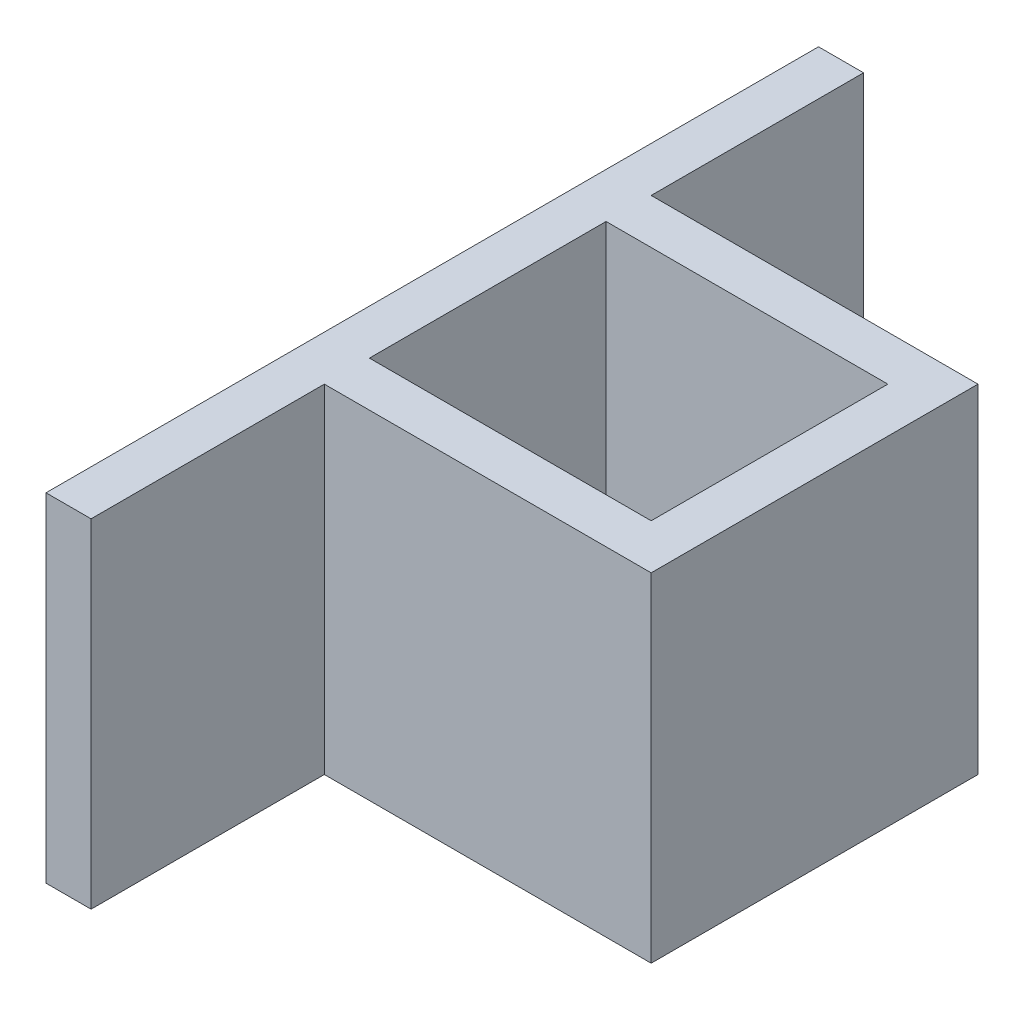
from build123d import *

# Parameters (mm, degrees)
SKETCH1_W           = 12.5
SKETCH1_H           = 10.5
BOSS_EXTRUDE1_DEPTH = 15


with BuildPart() as part:
    # Sketch1 → Boss-Extrude1 (new body)
    with BuildSketch(Plane(origin=(0, 0, 0), x_dir=(1, 0, 0), z_dir=(0, 1, 0))):
        Polygon((-2, 2), (-2, -12.5), (-2, -22.849015381), (0, -22.849015381), (0, -12.5), (14.5, -12.5), (14.5, 2), (0, 2), (0, 11.423967396), (-2, 11.423967396), align=None)
        with Locations((6.25, -5.25)):
            Rectangle(SKETCH1_W, SKETCH1_H, mode=Mode.SUBTRACT)
    extrude(amount=BOSS_EXTRUDE1_DEPTH)


solid = part.part
